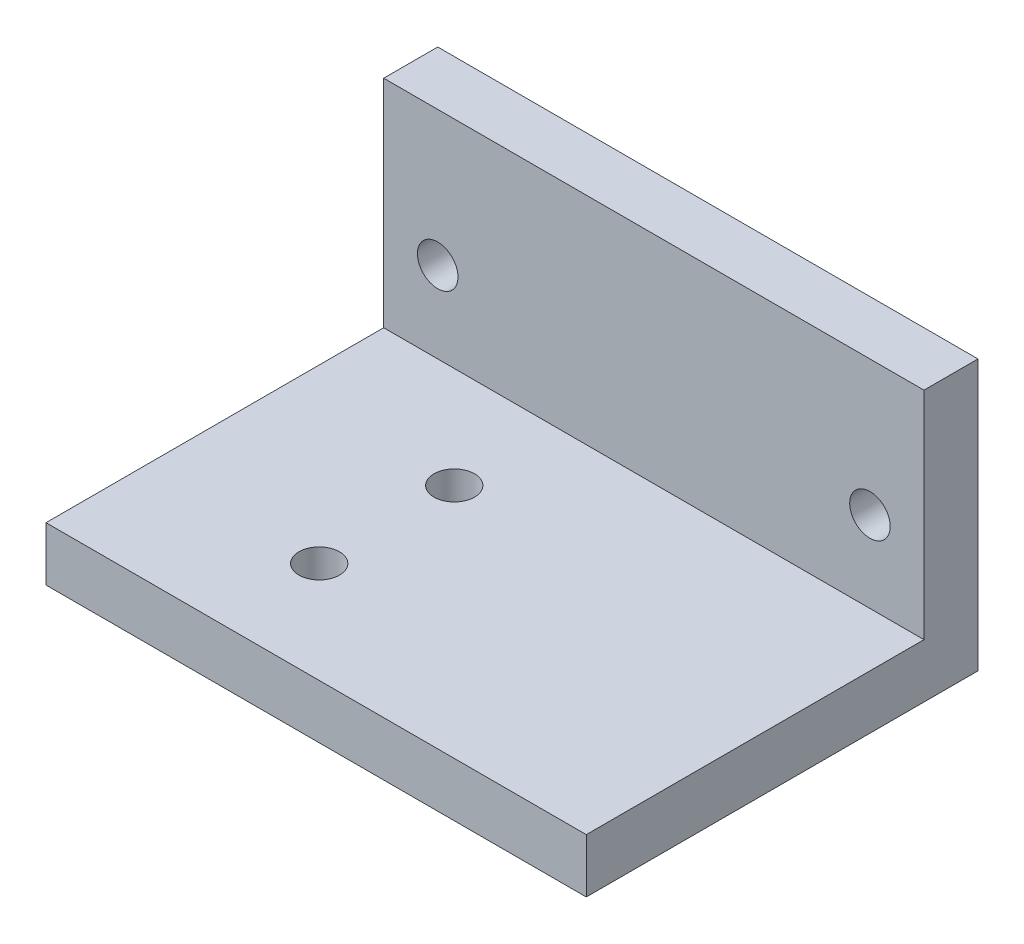
from build123d import *

# Parameters (mm, degrees)
SKETCH_1_W      = 40
SKETCH_1_H      = 20
SKETCH_1_R      = 1.5
EXTRUDE_1_DEPTH = 4
SKETCH_2_W      = 40
SKETCH_2_H      = 25
SKETCH_2_R      = 1.5
EXTRUDE_2_DEPTH = 4


with BuildPart() as part:
    # Эскиз1 → Бобышка-Вытянуть1 (new body)
    with BuildSketch(Plane.XY):
        Rectangle(SKETCH_1_W, SKETCH_1_H)
        with Locations((-16, 0)):
            Circle(SKETCH_1_R, mode=Mode.SUBTRACT)
        with Locations(Location((16, 0, 0), (0, 0, 180))):
            Circle(SKETCH_1_R, mode=Mode.SUBTRACT)
    extrude(amount=EXTRUDE_1_DEPTH)

    # Эскиз2 → Бобышка-Вытянуть2 (add)
    with BuildSketch(Plane.XZ.offset(10)):
        with Locations((0, 16.5)):
            Rectangle(SKETCH_2_W, SKETCH_2_H)
        with Locations(Location((-7.27406928, 21.5, 0), (0, 0, 270))):
            Circle(SKETCH_2_R, mode=Mode.SUBTRACT)
        with Locations(Location((-7.27406928, 11.5, 0), (0, 0, 270))):
            Circle(SKETCH_2_R, mode=Mode.SUBTRACT)
    extrude(amount=-EXTRUDE_2_DEPTH)


solid = part.part
